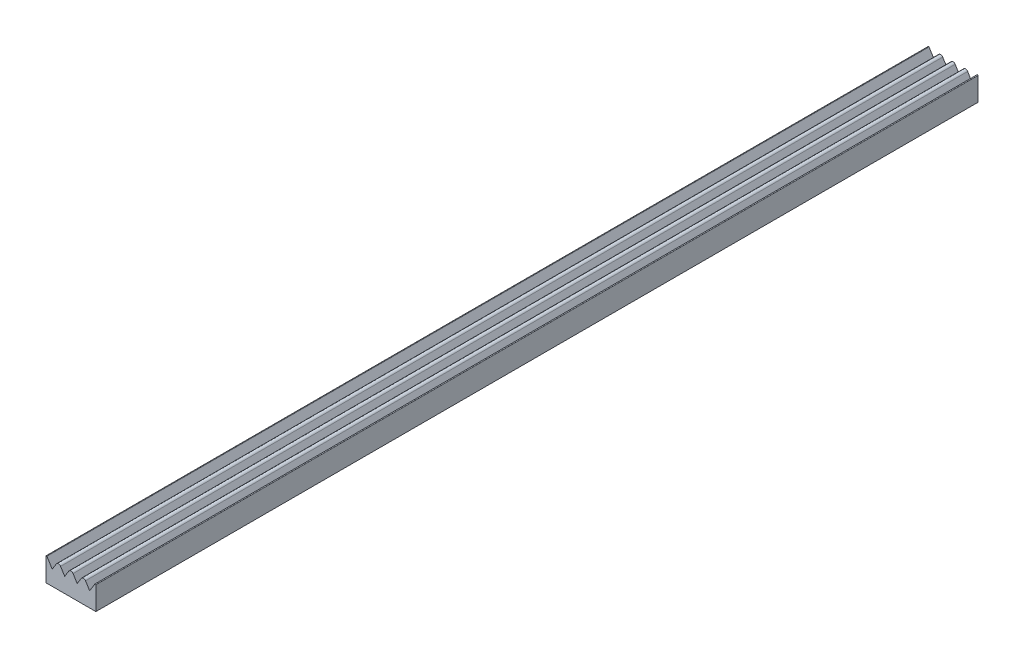
from build123d import *

# Parameters (mm, degrees)
BOSS_EXTRUDE1_DEPTH = 224.63125


with BuildPart() as part:
    # Sketch1 → Boss-Extrude1 (new body)
    with BuildSketch(Plane.XY):
        with BuildLine():
            Line((0, 0), (-12.7, 0))
            Line((-12.7, 0), (-12.7, 5.907176879))
            ThreePointArc((-12.7, 5.907176879), (-12.608011679, 6.02925547), (-12.465304215, 5.974486745))
            Line((-12.465304215, 5.974486745), (-11.1125, 3.81))
            Line((-11.1125, 3.81), (-10.063478923, 5.488433723))
            ThreePointArc((-10.063478923, 5.488433723), (-9.525, 5.786884396), (-8.986521077, 5.488433723))
            Line((-8.986521077, 5.488433723), (-7.9375, 3.81))
            Line((-7.9375, 3.81), (-6.888478923, 5.488433723))
            ThreePointArc((-6.888478923, 5.488433723), (-6.35, 5.786884396), (-5.811521077, 5.488433723))
            Line((-5.811521077, 5.488433723), (-4.7625, 3.81))
            Line((-4.7625, 3.81), (-3.713478923, 5.488433723))
            ThreePointArc((-3.713478923, 5.488433723), (-3.175, 5.786884396), (-2.636521077, 5.488433723))
            Line((-2.636521077, 5.488433723), (-1.5875, 3.81))
            Line((-1.5875, 3.81), (-0.234695785, 5.974486745))
            ThreePointArc((-0.234695785, 5.974486745), (-0.091988321, 6.02925547), (0, 5.907176879))
            Line((0, 5.907176879), (0, 0))
        make_face()
    extrude(amount=BOSS_EXTRUDE1_DEPTH)


solid = part.part
